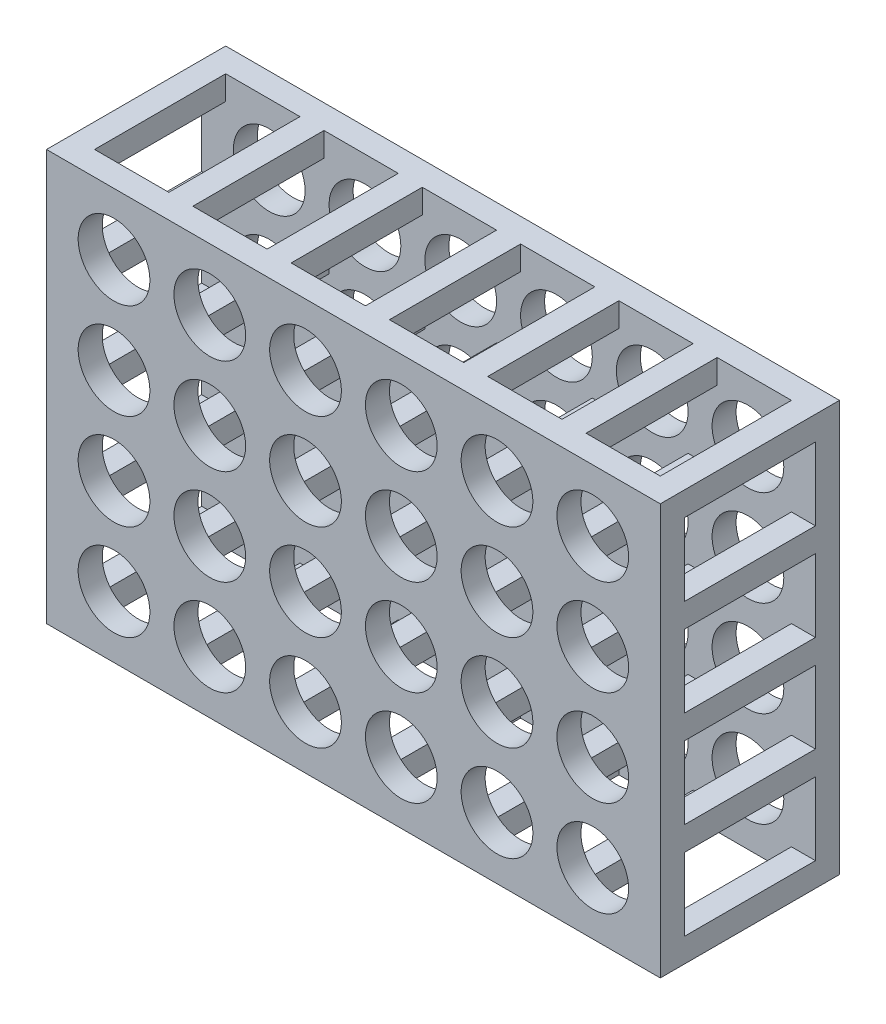
from build123d import *

# Parameters (mm, degrees)
SKETCH1_W            = 127.76
SKETCH1_H            = 85.48
BOSS_EXTRUDE1_DEPTH  = 5
SKETCH2_R            = 7.465
CUT_EXTRUDE1_DEPTH   = 95.825210988
SKETCH3_W            = 5
SKETCH3_H            = 5
BOSS_EXTRUDE2_DEPTH  = 13.65
LPATTERN2_COUNT      = 6
LPATTERN2_PITCH      = 19.93
LPATTERN2_COUNT_DIR2 = 4
LPATTERN2_PITCH_DIR2 = 19.93
LPATTERN3_COUNT      = 2
LPATTERN3_PITCH      = 122.76
LPATTERN3_COUNT_DIR2 = 5
LPATTERN3_PITCH_DIR2 = 20.12
LPATTERN5_COUNT      = 6
LPATTERN5_PITCH      = 20.46
LPATTERN5_COUNT_DIR2 = 2
LPATTERN5_PITCH_DIR2 = 80.48
SKETCH4_W            = 5
SKETCH4_H            = 5
BOSS_EXTRUDE3_DEPTH  = 13.65
LPATTERN4_COUNT      = 5
LPATTERN4_PITCH      = 19.93
LPATTERN4_COUNT_DIR2 = 3
LPATTERN4_PITCH_DIR2 = 19.93


with BuildPart() as part:
    # Sketch1 → Boss-Extrude1 (new body)
    with BuildSketch(Plane.XY):
        with Locations((9.206235294, -17.469823529)):
            Rectangle(SKETCH1_W, SKETCH1_H)
    extrude(amount=BOSS_EXTRUDE1_DEPTH)

    # Sketch2 → Cut-Extrude1 (cut, through all)
    with BuildSketch(Plane.XY.offset(5)):
        with Locations((-40.618764706, 12.425176471)):
            Circle(SKETCH2_R)
    cut_extrude1 = extrude(amount=-CUT_EXTRUDE1_DEPTH, mode=Mode.SUBTRACT)

    # Sketch3 → Boss-Extrude2 (add)
    with BuildSketch(Plane.XY.offset(5)):
        with Locations((-52.173764706, 22.770176471)):
            Rectangle(SKETCH3_W, SKETCH3_H)
    boss_extrude2 = extrude(amount=BOSS_EXTRUDE2_DEPTH)

    # LPattern2: Cut-Extrude1 6 × 4
    with Locations(*[(i * LPATTERN2_PITCH, -j * LPATTERN2_PITCH_DIR2, 0) for i in range(LPATTERN2_COUNT) for j in range(LPATTERN2_COUNT_DIR2) if (i, j) != (0, 0)]):
        add(cut_extrude1, mode=Mode.SUBTRACT)

    # LPattern3: Boss-Extrude2 2 × 5
    with Locations(*[(i * LPATTERN3_PITCH, -j * LPATTERN3_PITCH_DIR2, 0) for i in range(LPATTERN3_COUNT) for j in range(LPATTERN3_COUNT_DIR2) if (i, j) != (0, 0)]):
        add(boss_extrude2)

    # LPattern5: Boss-Extrude2 6 × 2
    with Locations(*[(i * LPATTERN5_PITCH, -j * LPATTERN5_PITCH_DIR2, 0) for i in range(LPATTERN5_COUNT) for j in range(LPATTERN5_COUNT_DIR2) if (i, j) != (0, 0)]):
        add(boss_extrude2)

    # Sketch4 → Boss-Extrude3 (add)
    with BuildSketch(Plane.XY.offset(5)):
        with Locations((-30.653764706, -37.399823529)):
            Rectangle(SKETCH4_W, SKETCH4_H)
    boss_extrude3 = extrude(amount=BOSS_EXTRUDE3_DEPTH)

    # LPattern4: Boss-Extrude3 5 × 3
    with Locations(*[(i * LPATTERN4_PITCH, j * LPATTERN4_PITCH_DIR2, 0) for i in range(LPATTERN4_COUNT) for j in range(LPATTERN4_COUNT_DIR2) if (i, j) != (0, 0)]):
        add(boss_extrude3)

    # Mirror9: part across plane


with BuildPart() as part_1:
    add(part.part)
    add(part.part.mirror(Plane(origin=(0, 0, 18.65), x_dir=(1, 0, 0), z_dir=(0, 0, -1))))


solid = part_1.part
